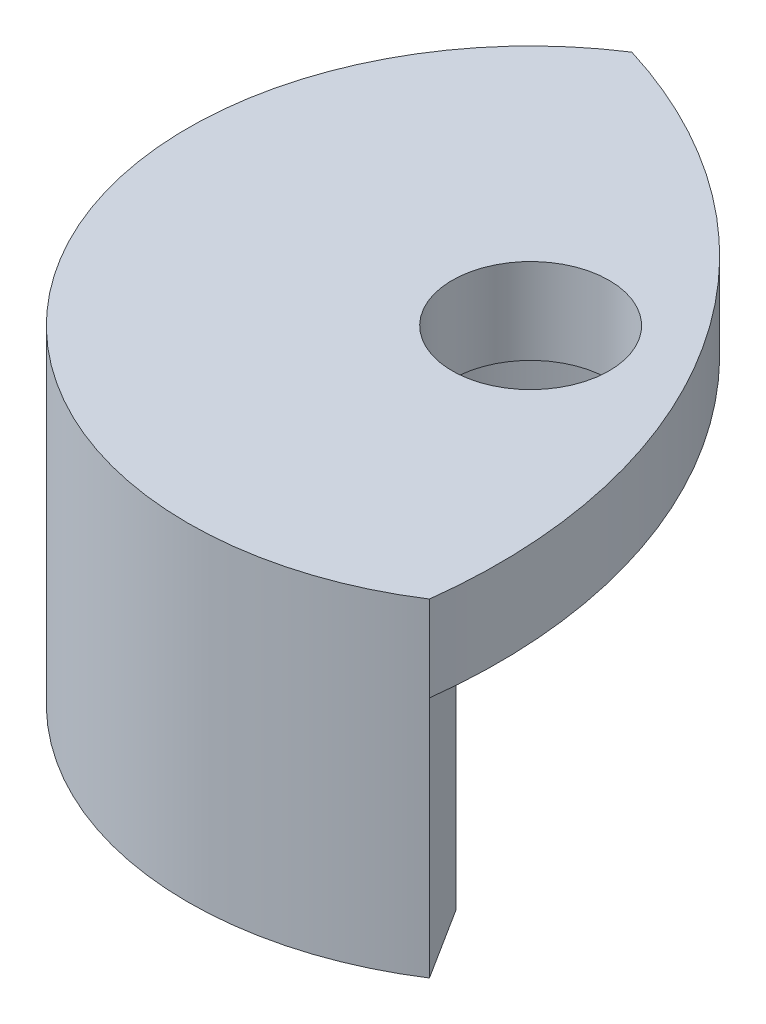
from build123d import *

# Parameters (mm, degrees)
EXTRUDE_2_DEPTH     = 17
EXTRUDE_3_DEPTH     = 6
SKETCH_5_R          = 4.5
CUT_EXTRUDE_1_DEPTH = 6
SKETCH_7_R          = 1.3
CUT_EXTRUDE_2_DEPTH = 10
SKETCH1_R           = 5.5
CUT_EXTRUDE1_DEPTH  = 38.960505792
CUT_EXTRUDE_3_REACH = 39.961
SKETCH_10_R         = 18


with BuildPart() as part:
    # 草图2 → 凸台-拉伸2 (new body)
    with BuildSketch(Plane(origin=(0, 0, 0), x_dir=(1, 0, 0), z_dir=(0, 1, 0))):
        with BuildLine():
            Line((-13.050585614, 20.141554437), (-8.239089232, 12.534648325))
            ThreePointArc((-8.239089232, 12.534648325), (-12.534648325, -8.239089232), (8.239089232, -12.534648325))
            Line((8.239089232, -12.534648325), (13.050585614, -20.141554437))
            ThreePointArc((13.050585614, -20.141554437), (-20.141554437, -13.050585614), (-13.050585614, 20.141554437))
        make_face()
    extrude(amount=EXTRUDE_2_DEPTH)

    # 草图4 → 凸台-拉伸3 (add)
    with BuildSketch(Plane(origin=(0, 17, 0), x_dir=(1, 0, 0), z_dir=(0, 1, 0))):
        with BuildLine():
            ThreePointArc((13.050585614, -20.141554437), (-20.141554437, -13.050585614), (-13.050585614, 20.141554437))
            ThreePointArc((-13.050585614, 20.141554437), (7.331987605, 4.750712377), (13.050585614, -20.141554437))
        make_face()
    extrude(amount=EXTRUDE_3_DEPTH)

    # 草图5 → 切除-拉伸1 (cut)
    with BuildSketch(Plane(origin=(0, 23, 0), x_dir=(1, 0, 0), z_dir=(0, 1, 0))):
        with Locations(Location((0, 0, 0), (0, 0, 270))):
            Circle(SKETCH_5_R)
    extrude(amount=-CUT_EXTRUDE_1_DEPTH, mode=Mode.SUBTRACT)

    # 草图7 → 切除-拉伸2 (cut)
    with BuildSketch(Plane.XZ):
        with Locations(Location((-17.423360164, -8.756513039, 0), (0, 0, 270))):
            Circle(SKETCH_7_R)
        with Locations(Location((-16.295042822, 10.710816001, 0), (0, 0, 270))):
            Circle(SKETCH_7_R)
        with Locations(Location((1.128317341, 19.467329041, 0), (0, 0, 270))):
            Circle(SKETCH_7_R)
    extrude(amount=-CUT_EXTRUDE_2_DEPTH, mode=Mode.SUBTRACT)

    # Sketch1 → Cut-Extrude1 (cut, through all)
    with BuildSketch(Plane.XZ.offset(-17)):
        with Locations(Location((0, 0, 0), (0, 0, 270))):
            Circle(SKETCH1_R)
    extrude(amount=-CUT_EXTRUDE1_DEPTH, mode=Mode.SUBTRACT)

    # 草图10 → 切除-拉伸3 (cut, up to next)
    with BuildSketch(Plane.XZ.offset(-17), mode=Mode.PRIVATE) as cut_extrude_3_sk1:
        Circle(SKETCH_10_R)
    cut_extrude_3_tool1 = extrude(cut_extrude_3_sk1.sketch, amount=CUT_EXTRUDE_3_REACH, mode=Mode.PRIVATE) & part.part
    add(cut_extrude_3_tool1.solids().sort_by_distance((0, 17, 0))[0], mode=Mode.SUBTRACT)


solid = part.part
